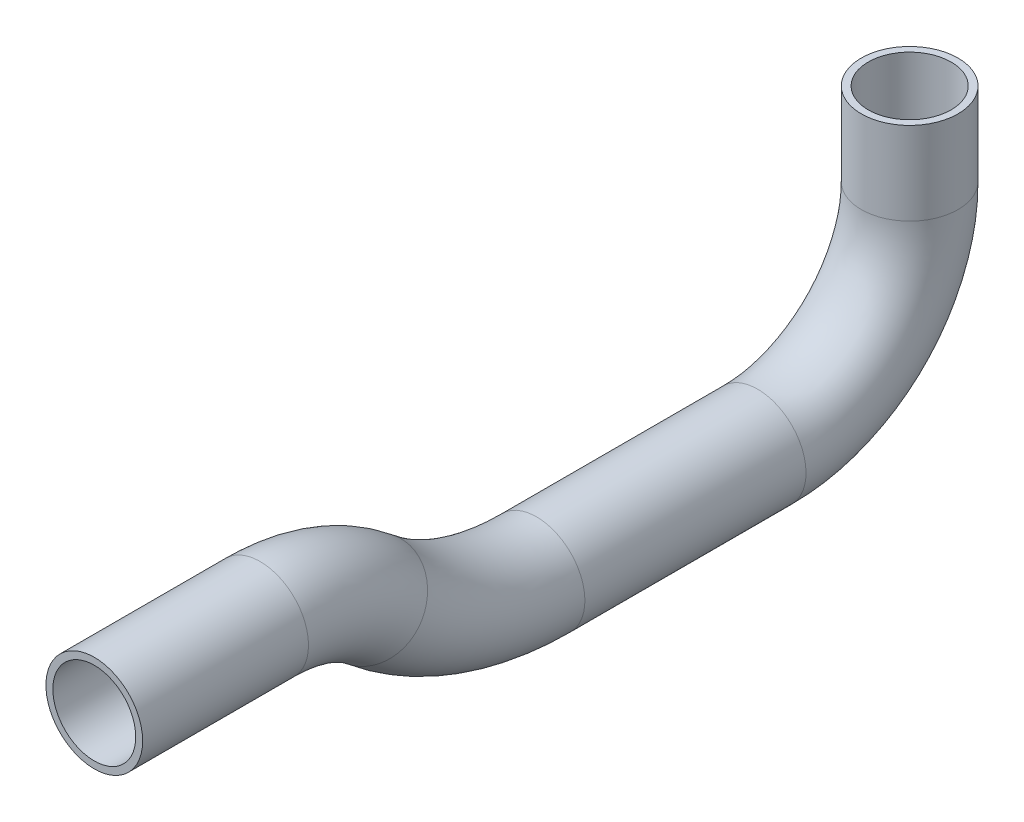
from build123d import *

# Parameters (mm, degrees)
SKETCH7_R   = 3.5
SKETCH7_R_2 = 3


with BuildPart() as part:
    # Sweep3: sweep along a path in Sketch6
    with BuildLine(Plane(origin=(0, 0, 0), x_dir=(0, 0, -1), z_dir=(1, 0, 0))) as sweep3_path:
        Line((0, 0), (12, 0))
        ThreePointArc((12, 0), (16.233993353, -0.738907352), (19.967422096, -2.868271955))
        ThreePointArc((19.967422096, -2.868271955), (25.605729149, -6.084085697), (32, -7.2))
        Line((32, -7.2), (48, -7.2))
        ThreePointArc((48, -7.2), (55.778174593, -3.978174593), (59, 3.8))
        Line((59, 3.8), (59, 9.8))
    # Sketch7 → Sweep3 (sweep)
    with BuildSketch(Plane.XY):
        Circle(SKETCH7_R)
        Circle(SKETCH7_R_2, mode=Mode.SUBTRACT)
    sweep(path=sweep3_path.line)


solid = part.part
